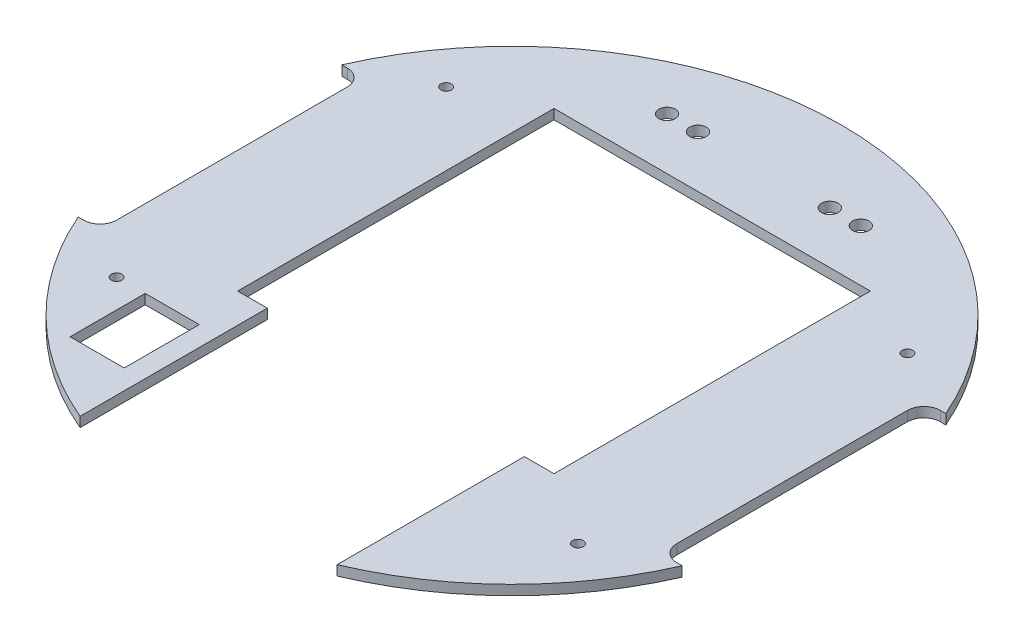
from build123d import *

# Parameters (mm, degrees)
SKETCH_1_W      = 16.4
SKETCH_1_H      = 22.8
SKETCH_1_R      = 1.6
SKETCH_1_R_2    = 2.5
EXTRUDE_1_DEPTH = 3


with BuildPart() as part:
    # 草圖1 → 填料-伸長1 (new body)
    with BuildSketch(Plane(origin=(0, 0, 0), x_dir=(1, 0, 0), z_dir=(0, 1, 0))):
        with BuildLine():
            ThreePointArc((39, -92.081485653), (70.324780895, -71.094480742), (91.651513899, -40))
            Line((91.651513899, -40), (90, -40))
            ThreePointArc((90, -40), (86.464466094, -38.535533906), (85, -35))
            Line((85, -35), (85, 35))
            ThreePointArc((85, 35), (86.464466094, 38.535533906), (90, 40))
            Line((90, 40), (91.651513899, 40))
            ThreePointArc((91.651513899, 40), (0, 100), (-91.651513899, 40))
            Line((-91.651513899, 40), (-90, 40))
            ThreePointArc((-90, 40), (-86.464466094, 38.535533906), (-85, 35))
            Line((-85, 35), (-85, -35))
            ThreePointArc((-85, -35), (-86.464466094, -38.535533906), (-90, -40))
            Line((-90, -40), (-91.651513899, -40))
            ThreePointArc((-91.651513899, -40), (-70.324780895, -71.094480742), (-39, -92.081485653))
            Line((-39, -92.081485653), (-39, -35.26))
            Line((-39, -35.26), (-48, -35.26))
            Line((-48, -35.26), (-48, 60.74))
            Line((-48, 60.74), (48, 60.74))
            Line((48, 60.74), (48, -35.26))
            Line((48, -35.26), (39, -35.26))
            Line((39, -35.26), (39, -92.081485653))
        make_face()
        with Locations((-53.204834595, -61.300870246)):
            Rectangle(SKETCH_1_W, SKETCH_1_H, mode=Mode.SUBTRACT)
        with Locations(Location((-70, -50, 0), (0, 0, 270))):
            Circle(SKETCH_1_R, mode=Mode.SUBTRACT)
        with Locations(Location((70, -50, 0), (0, 0, 270))):
            Circle(SKETCH_1_R, mode=Mode.SUBTRACT)
        with Locations(Location((-70, 50, 0), (0, 0, 270))):
            Circle(SKETCH_1_R, mode=Mode.SUBTRACT)
        with Locations(Location((-29.4, 76.443273383, 0), (0, 0, 270))):
            Circle(SKETCH_1_R_2, mode=Mode.SUBTRACT)
        with Locations(Location((-20, 76.443273383, 0), (0, 0, 270))):
            Circle(SKETCH_1_R_2, mode=Mode.SUBTRACT)
        with Locations(Location((20, 76.443273383, 0), (0, 0, 270))):
            Circle(SKETCH_1_R_2, mode=Mode.SUBTRACT)
        with Locations(Location((29.4, 76.443273383, 0), (0, 0, 270))):
            Circle(SKETCH_1_R_2, mode=Mode.SUBTRACT)
        with Locations(Location((70, 50, 0), (0, 0, 270))):
            Circle(SKETCH_1_R, mode=Mode.SUBTRACT)
    extrude(amount=EXTRUDE_1_DEPTH)


solid = part.part
